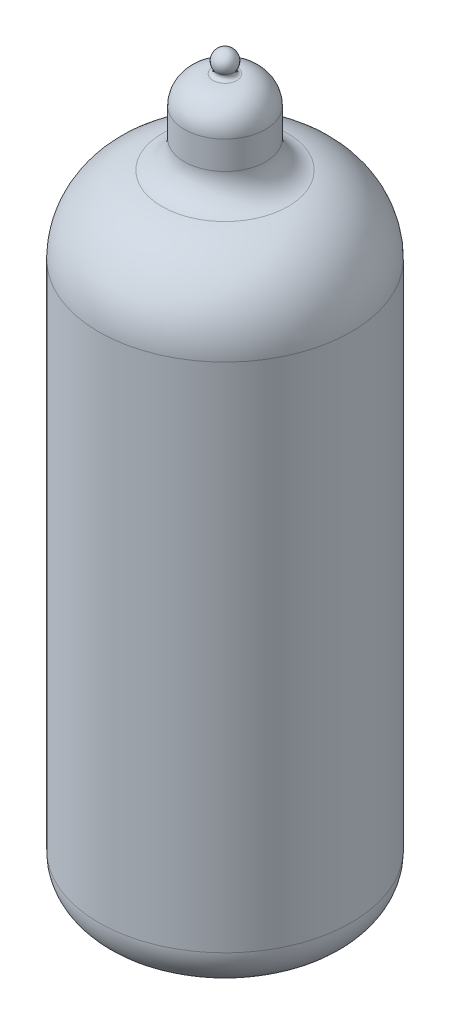
from build123d import *

# Parameters (mm, degrees)
CUT_EXTRUDE1_REACH = 56.021
SKETCH2_R          = 0.25
SKETCH3_R          = 3
CUT_EXTRUDE2_DEPTH = 0.5
CUT_EXTRUDE2_DRAFT = -15


with BuildPart() as part:
    # Sketch1 → Revolve1 (revolve)
    with BuildSketch(Plane.XY, mode=Mode.PRIVATE) as revolve1_sk:
        with BuildLine():
            Line((0, -26.25), (-6, -26.25))
            ThreePointArc((-6, -26.25), (-8.121320344, -25.371320344), (-9, -23.25))
            Line((-9, -23.25), (-9, 13.25))
            ThreePointArc((-9, 13.25), (-7.73164929, 16.803167601), (-4.5, 18.75))
            ThreePointArc((-4.5, 18.75), (-3.348125006, 19.443920459), (-2.896039604, 20.71039604))
            Line((-2.896039604, 20.71039604), (-2.896039604, 22.71039604))
            ThreePointArc((-2.896039604, 22.71039604), (-2.293006224, 24.141648729), (-0.847555343, 24.709808272))
            ThreePointArc((-0.847555343, 24.709808272), (-0.623570884, 24.837222914), (-0.631121107, 25.094801101))
            ThreePointArc((-0.631121107, 25.094801101), (-0.658178993, 25.859583666), (0, 26.25))
            Line((0, 26.25), (0, 24.21039604))
            Line((0, 24.21039604), (-0.896039604, 24.21039604))
            ThreePointArc((-0.896039604, 24.21039604), (-1.956699776, 23.771056211), (-2.396039604, 22.71039604))
            Line((-2.396039604, 22.71039604), (-2.396039604, 20.71039604))
            ThreePointArc((-2.396039604, 20.71039604), (-2.961146356, 19.127301564), (-4.400990099, 18.25990099))
            ThreePointArc((-4.400990099, 18.25990099), (-7.34467064, 16.486548706), (-8.5, 13.25))
            Line((-8.5, 13.25), (-8.5, -21.25))
            ThreePointArc((-8.5, -21.25), (-8.207106781, -21.957106781), (-7.5, -22.25))
            Line((-7.5, -22.25), (0, -22.25))
            Line((0, -22.25), (0, -26.25))
        make_face()
    revolve(revolve1_sk.sketch.rotate(Axis((0, 26.25, 0), (0, -1, 0)), 270), axis=Axis((0, 26.25, 0), (0, -1, 0)))

    # Sketch2 → Cut-Extrude1 (cut, up to next)
    with BuildSketch(Plane.XZ.offset(26.25), mode=Mode.PRIVATE) as cut_extrude1_sk1:
        with Locations(Location((0, -5.75, 0), (0, 0, 270))):
            Circle(SKETCH2_R)
    cut_extrude1_tool1 = extrude(cut_extrude1_sk1.sketch, amount=-CUT_EXTRUDE1_REACH, mode=Mode.PRIVATE) & part.part
    # Sketch2 → Cut-Extrude1 (cut, up to next)
    with BuildSketch(Plane.XZ.offset(26.25), mode=Mode.PRIVATE) as cut_extrude1_sk2:
        with Locations(Location((-2.672158239, -5.091372148, 0), (0, 0, 242.309347727))):
            Circle(SKETCH2_R)
    cut_extrude1_tool2 = extrude(cut_extrude1_sk2.sketch, amount=-CUT_EXTRUDE1_REACH, mode=Mode.PRIVATE) & part.part
    # Sketch2 → Cut-Extrude1 (cut, up to next)
    with BuildSketch(Plane.XZ.offset(26.25), mode=Mode.PRIVATE) as cut_extrude1_sk3:
        with Locations(Location((-4.732157229, -3.266372294, 0), (0, 0, 214.617040042))):
            Circle(SKETCH2_R)
    cut_extrude1_tool3 = extrude(cut_extrude1_sk3.sketch, amount=-CUT_EXTRUDE1_REACH, mode=Mode.PRIVATE) & part.part
    # Sketch2 → Cut-Extrude1 (cut, up to next)
    with BuildSketch(Plane.XZ.offset(26.25), mode=Mode.PRIVATE) as cut_extrude1_sk4:
        with Locations(Location((-5.708076026, -0.693085911, 0), (0, 0, 186.924732353))):
            Circle(SKETCH2_R)
    cut_extrude1_tool4 = extrude(cut_extrude1_sk4.sketch, amount=-CUT_EXTRUDE1_REACH, mode=Mode.PRIVATE) & part.part
    # Sketch2 → Cut-Extrude1 (cut, up to next)
    with BuildSketch(Plane.XZ.offset(26.25), mode=Mode.PRIVATE) as cut_extrude1_sk5:
        with Locations(Location((-5.376343395, 2.0389781, 0), (0, 0, 159.232424661))):
            Circle(SKETCH2_R)
    cut_extrude1_tool5 = extrude(cut_extrude1_sk5.sketch, amount=-CUT_EXTRUDE1_REACH, mode=Mode.PRIVATE) & part.part
    # Sketch2 → Cut-Extrude1 (cut, up to next)
    with BuildSketch(Plane.XZ.offset(26.25), mode=Mode.PRIVATE) as cut_extrude1_sk6:
        with Locations(Location((-3.812955285, 4.303936802, 0), (0, 0, 131.540116943))):
            Circle(SKETCH2_R)
    cut_extrude1_tool6 = extrude(cut_extrude1_sk6.sketch, amount=-CUT_EXTRUDE1_REACH, mode=Mode.PRIVATE) & part.part
    # Sketch2 → Cut-Extrude1 (cut, up to next)
    with BuildSketch(Plane.XZ.offset(26.25), mode=Mode.PRIVATE) as cut_extrude1_sk7:
        with Locations(Location((-1.37606507, 5.58291545, 0), (0, 0, 103.847809302))):
            Circle(SKETCH2_R)
    cut_extrude1_tool7 = extrude(cut_extrude1_sk7.sketch, amount=-CUT_EXTRUDE1_REACH, mode=Mode.PRIVATE) & part.part
    # Sketch2 → Cut-Extrude1 (cut, up to next)
    with BuildSketch(Plane.XZ.offset(26.25), mode=Mode.PRIVATE) as cut_extrude1_sk8:
        with Locations(Location((1.37606507, 5.58291545, 0), (0, 0, 76.155501574))):
            Circle(SKETCH2_R)
    cut_extrude1_tool8 = extrude(cut_extrude1_sk8.sketch, amount=-CUT_EXTRUDE1_REACH, mode=Mode.PRIVATE) & part.part
    # Sketch2 → Cut-Extrude1 (cut, up to next)
    with BuildSketch(Plane.XZ.offset(26.25), mode=Mode.PRIVATE) as cut_extrude1_sk9:
        with Locations(Location((3.812955285, 4.303936802, 0), (0, 0, 48.463193888))):
            Circle(SKETCH2_R)
    cut_extrude1_tool9 = extrude(cut_extrude1_sk9.sketch, amount=-CUT_EXTRUDE1_REACH, mode=Mode.PRIVATE) & part.part
    # Sketch2 → Cut-Extrude1 (cut, up to next)
    with BuildSketch(Plane.XZ.offset(26.25), mode=Mode.PRIVATE) as cut_extrude1_sk10:
        with Locations(Location((5.376343395, 2.0389781, 0), (0, 0, 20.770886189))):
            Circle(SKETCH2_R)
    cut_extrude1_tool10 = extrude(cut_extrude1_sk10.sketch, amount=-CUT_EXTRUDE1_REACH, mode=Mode.PRIVATE) & part.part
    # Sketch2 → Cut-Extrude1 (cut, up to next)
    with BuildSketch(Plane.XZ.offset(26.25), mode=Mode.PRIVATE) as cut_extrude1_sk11:
        with Locations(Location((5.708076026, -0.693085911, 0), (0, 0, 353.078578487))):
            Circle(SKETCH2_R)
    cut_extrude1_tool11 = extrude(cut_extrude1_sk11.sketch, amount=-CUT_EXTRUDE1_REACH, mode=Mode.PRIVATE) & part.part
    # Sketch2 → Cut-Extrude1 (cut, up to next)
    with BuildSketch(Plane.XZ.offset(26.25), mode=Mode.PRIVATE) as cut_extrude1_sk12:
        with Locations(Location((4.732157229, -3.266372294, 0), (0, 0, 325.386270825))):
            Circle(SKETCH2_R)
    cut_extrude1_tool12 = extrude(cut_extrude1_sk12.sketch, amount=-CUT_EXTRUDE1_REACH, mode=Mode.PRIVATE) & part.part
    # Sketch2 → Cut-Extrude1 (cut, up to next)
    with BuildSketch(Plane.XZ.offset(26.25), mode=Mode.PRIVATE) as cut_extrude1_sk13:
        with Locations(Location((2.672158239, -5.091372148, 0), (0, 0, 297.693963112))):
            Circle(SKETCH2_R)
    cut_extrude1_tool13 = extrude(cut_extrude1_sk13.sketch, amount=-CUT_EXTRUDE1_REACH, mode=Mode.PRIVATE) & part.part
    add(cut_extrude1_tool1.solids().sort_by_distance((0, -26.25, -5.75))[0], mode=Mode.SUBTRACT)
    add(cut_extrude1_tool2.solids().sort_by_distance((-2.672158, -26.25, -5.091372))[0], mode=Mode.SUBTRACT)
    add(cut_extrude1_tool3.solids().sort_by_distance((-4.732157, -26.25, -3.266372))[0], mode=Mode.SUBTRACT)
    add(cut_extrude1_tool4.solids().sort_by_distance((-5.708076, -26.25, -0.693086))[0], mode=Mode.SUBTRACT)
    add(cut_extrude1_tool5.solids().sort_by_distance((-5.376343, -26.25, 2.038978))[0], mode=Mode.SUBTRACT)
    add(cut_extrude1_tool6.solids().sort_by_distance((-3.812955, -26.25, 4.303937))[0], mode=Mode.SUBTRACT)
    add(cut_extrude1_tool7.solids().sort_by_distance((-1.376065, -26.25, 5.582915))[0], mode=Mode.SUBTRACT)
    add(cut_extrude1_tool8.solids().sort_by_distance((1.376065, -26.25, 5.582915))[0], mode=Mode.SUBTRACT)
    add(cut_extrude1_tool9.solids().sort_by_distance((3.812955, -26.25, 4.303937))[0], mode=Mode.SUBTRACT)
    add(cut_extrude1_tool10.solids().sort_by_distance((5.376343, -26.25, 2.038978))[0], mode=Mode.SUBTRACT)
    add(cut_extrude1_tool11.solids().sort_by_distance((5.708076, -26.25, -0.693086))[0], mode=Mode.SUBTRACT)
    add(cut_extrude1_tool12.solids().sort_by_distance((4.732157, -26.25, -3.266372))[0], mode=Mode.SUBTRACT)
    add(cut_extrude1_tool13.solids().sort_by_distance((2.672158, -26.25, -5.091372))[0], mode=Mode.SUBTRACT)


with BuildPart() as cut_extrude2_tool:
    # Sketch3 → Cut-Extrude2 (with draft: the straight prism first)
    with BuildSketch(Plane.XZ.offset(26.25)):
        Circle(SKETCH3_R)
        Polygon((0.375, 2.5), (-0.375, 2.5), (-0.375, -0.75), (-0.75, -0.75), (0, -2.5), (0.75, -0.75), (0.375, -0.75), align=None, mode=Mode.SUBTRACT)
    extrude(amount=-CUT_EXTRUDE2_DEPTH)
    # Cut-Extrude2: the draft: its side faces are tilted about the plane it starts from
    cut_extrude2_sides = [cut_extrude2_tool.faces().sort_by_distance(p)[0] for p in [
        (-3, -26, 0),
        (0.375, -26, 0.875),
        (0.5625, -26, -0.75),
        (0.375, -26, -1.625),
        (-0.375, -26, -1.625),
        (-0.5625, -26, -0.75),
        (-0.375, -26, 0.875),
        (0, -26, 2.5),
    ]]
    draft(cut_extrude2_sides, Plane.XZ.offset(26.25), CUT_EXTRUDE2_DRAFT)


with BuildPart() as part_1:
    add(part.part)

    # Cut-Extrude2: cut by cut_extrude2_tool
    add(cut_extrude2_tool.part, mode=Mode.SUBTRACT)


solid = part_1.part
